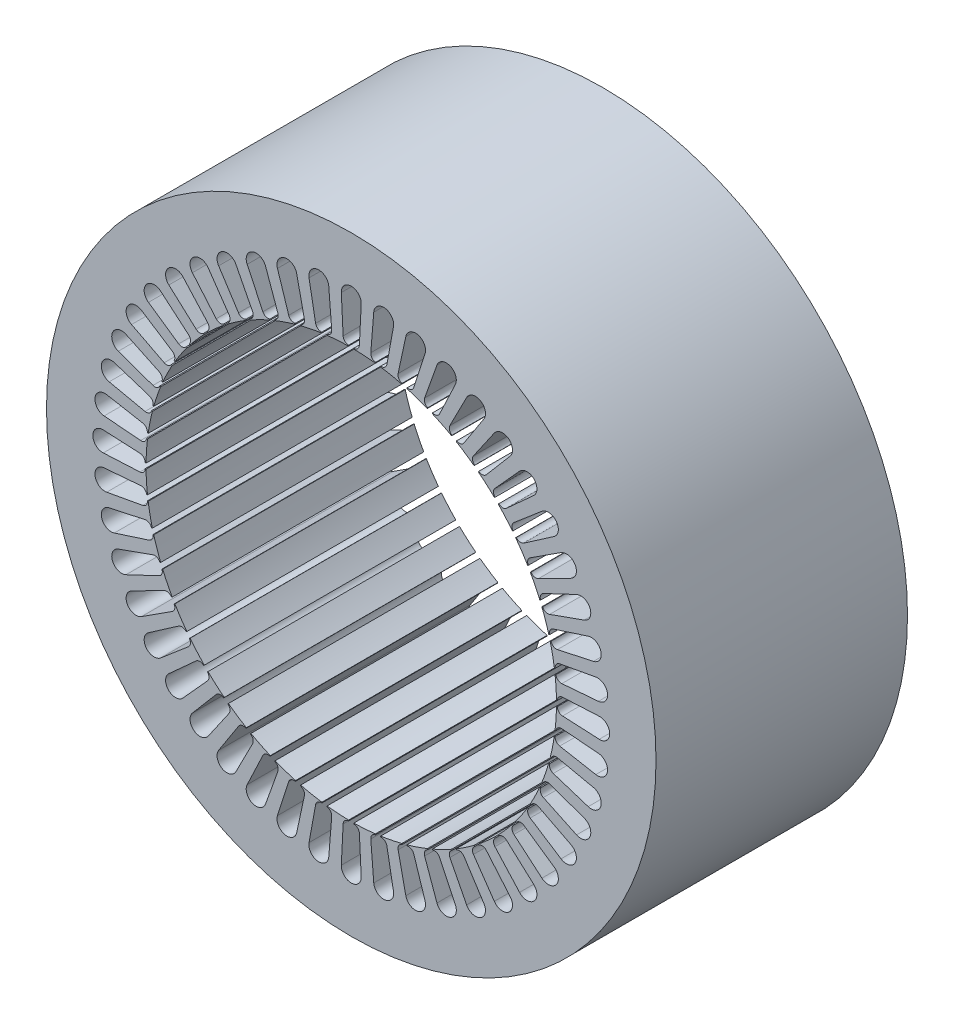
from build123d import *

# Parameters (mm, degrees)
SKETCH1_R             = 174.5
SKETCH1_R_2           = 117.5
DIAMETERS_DEPTH       = 72
SLOT_START            = -144
SLOT_DEPTH            = 144
NUMBER_OF_SLOTS_COUNT = 48


with BuildPart() as part:
    # Sketch1 → Diameters (new, symmetric)
    with BuildSketch(Plane.XY):
        Circle(SKETCH1_R)
        Circle(SKETCH1_R_2, mode=Mode.SUBTRACT)
    extrude(amount=DIAMETERS_DEPTH, both=True)

    # Sketch2 → Slot (cut)
    with BuildSketch(Plane.XY.offset(72).offset(SLOT_START)):
        with BuildLine():
            Line((117.490425142, 1.5), (117.990425142, 1.5))
            ThreePointArc((117.990425142, 1.5), (118.859185024, 3.673771087), (120.986860184, 4.65))
            Line((120.986860184, 4.65), (141.986860184, 5.7))
            ThreePointArc((141.986860184, 5.7), (146.205350723, 4.13507886), (147.978980736, 0))
            ThreePointArc((147.978980736, 0), (146.205350723, -4.13507886), (141.986860184, -5.7))
            Line((141.986860184, -5.7), (120.986860184, -4.65))
            ThreePointArc((120.986860184, -4.65), (118.859185024, -3.673771087), (117.990425142, -1.5))
            Line((117.990425142, -1.5), (117.490425142, -1.5))
            ThreePointArc((117.490425142, -1.5), (117.5, 0), (117.490425142, 1.5))
        make_face()
    slot = extrude(amount=SLOT_DEPTH, mode=Mode.SUBTRACT)

    # Number of Slots: Slot ×48 about axis
    number_of_slots_axis = Axis((0, 0, 0), (0, 0, 1))
    for i in range(1, NUMBER_OF_SLOTS_COUNT):
        add(slot.rotate(number_of_slots_axis, i * 360 / NUMBER_OF_SLOTS_COUNT), mode=Mode.SUBTRACT)


solid = part.part
